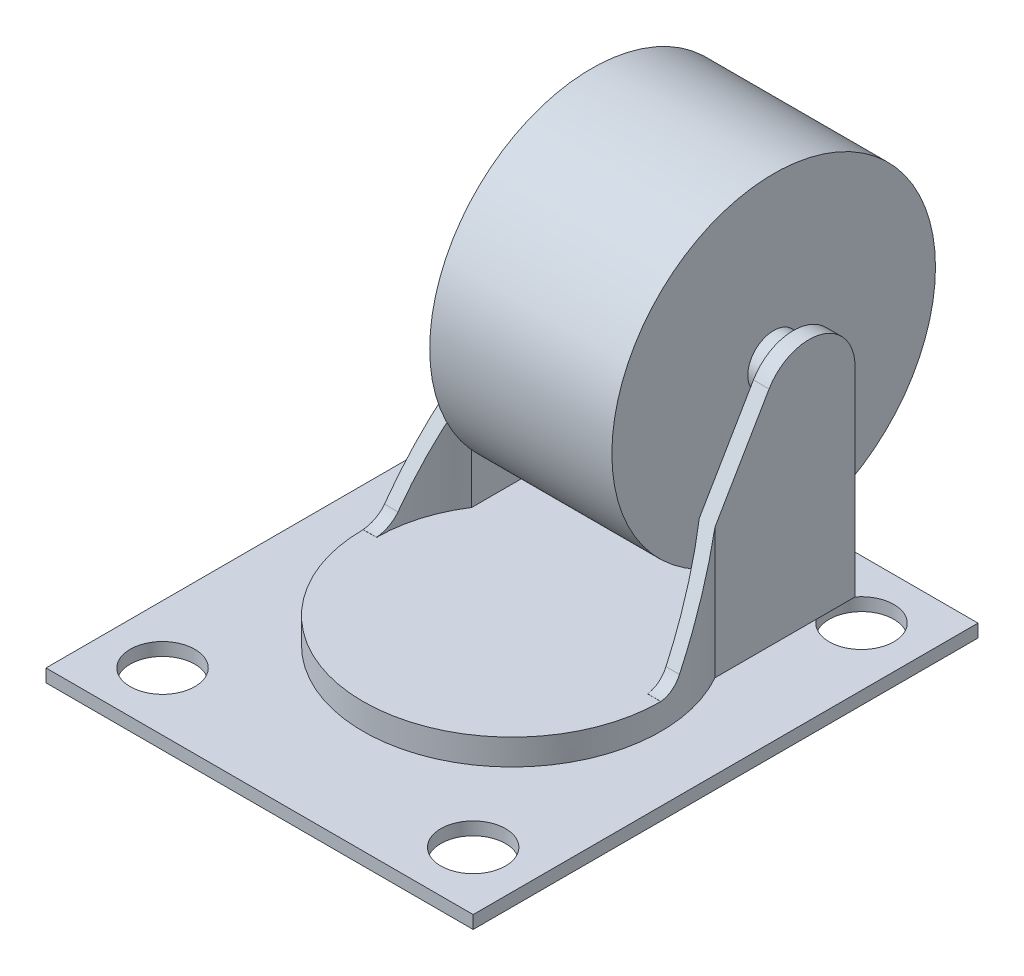
from build123d import *
from build123d.topology import SkipClean

# Parameters (mm, degrees)
SKETCH1_W               = 33
SKETCH1_H               = 39
SKETCH1_R               = 2.5
BOSS_EXTRUDE1_DEPTH     = 1
BOSS_EXTRUDE2_DEPTH     = 2
BOSS_EXTRUDE3_START     = -17
BOSS_EXTRUDE3_DEPTH     = 17
CUT_EXTRUDE1_DEPTH      = 39.503246616
CUT_EXTRUDE1_DEPTH_BACK = 39.503246616


with BuildPart() as part:
    # Sketch1 → Boss-Extrude1 (new body)
    with BuildSketch(Plane(origin=(0, 0, 0), x_dir=(1, 0, 0), z_dir=(0, 1, 0))):
        Rectangle(SKETCH1_W, SKETCH1_H)
        with Locations(Location((12, -15, 0), (0, 0, 270))):
            Circle(SKETCH1_R, mode=Mode.SUBTRACT)
        with Locations(Location((-12, -15, 0), (0, 0, 270))):
            Circle(SKETCH1_R, mode=Mode.SUBTRACT)
        with Locations(Location((-12, 15, 0), (0, 0, 270))):
            Circle(SKETCH1_R, mode=Mode.SUBTRACT)
        with Locations(Location((12, 15, 0), (0, 0, 270))):
            Circle(SKETCH1_R, mode=Mode.SUBTRACT)
    extrude(amount=BOSS_EXTRUDE1_DEPTH)

    # Sketch2 → Boss-Extrude2 (add)
    with BuildSketch(Plane(origin=(0, 1, 0), x_dir=(1, 0, 0), z_dir=(0, 1, 0))):
        with BuildLine():
            Line((10, 5.678908346), (10, 16.5))
            Line((10, 16.5), (-10, 16.5))
            Line((-10, 16.5), (-10, 5.678908346))
            ThreePointArc((-10, 5.678908346), (0, -11.5), (10, 5.678908346))
        make_face()
    extrude(amount=BOSS_EXTRUDE2_DEPTH)

    # Sketch3 → Boss-Extrude3 (add)
    with SkipClean():  # the faces are left unmerged after this step: merging them gives an invalid solid
        with BuildSketch(Plane(origin=(0, 20, 0), x_dir=(1, 0, 0), z_dir=(0, 1, 0)).offset(BOSS_EXTRUDE3_START)):
            with BuildLine():
                Line((-10.466352676, 0), (-11.5, 0))
                ThreePointArc((-11.5, 0), (-11.118677979, 2.936835031), (-10, 5.678908346))
                Line((-10, 5.678908346), (-10, 16.5))
                Line((-10, 16.5), (-8.791731248, 16.5))
                Line((-8.791731248, 16.5), (-8.791731248, 5.678908346))
                ThreePointArc((-8.791731248, 5.678908346), (-10.038971516, 2.960336), (-10.466352676, 0))
            make_face()
            with BuildLine():
                Line((8.791731248, 16.5), (8.791731248, 5.678908346))
                ThreePointArc((8.791731248, 5.678908346), (10.038971516, 2.960336), (10.466352676, 0))
                Line((10.466352676, 0), (11.5, 0))
                ThreePointArc((11.5, 0), (11.118677979, 2.936835031), (10, 5.678908346))
                Line((10, 5.678908346), (10, 16.5))
                Line((10, 16.5), (8.791731248, 16.5))
            make_face()
        extrude(amount=BOSS_EXTRUDE3_DEPTH)

    # Sketch4 → Cut-Extrude1 (cut, two sides: drawn at the far end of the back side and taken through both)
    with SkipClean():  # the faces are left unmerged after this step: merging them gives an invalid solid
        with BuildSketch(Plane(origin=(10, 0, 0), x_dir=(0, 0, -1), z_dir=(1, 0, 0)).offset(-CUT_EXTRUDE1_DEPTH_BACK)):
            with BuildLine():
                Line((-2.613781241, 3), (-0.185143028, 3))
                ThreePointArc((-0.185143028, 3), (0.810549083, 3.265469165), (1.541915642, 3.991402781))
                Line((1.541915642, 3.991402781), (9.859295901, 18.23356349))
                ThreePointArc((9.859295901, 18.23356349), (13.867346815, 19.876273461), (16.5, 16.436490709))
                Line((16.5, 16.436490709), (17.783999393, 20))
                Line((17.783999393, 20), (0.550387099, 24.196515301))
                Line((0.550387099, 24.196515301), (-11.381791723, 8.604740189))
                Line((-11.381791723, 8.604740189), (-2.613781241, 3))
            make_face()
        extrude(amount=CUT_EXTRUDE1_DEPTH + CUT_EXTRUDE1_DEPTH_BACK, mode=Mode.SUBTRACT)

    # Sketch5 → Revolve1 (revolve)
    with SkipClean():  # the faces are left unmerged after this step: merging them gives an invalid solid
        with BuildSketch(Plane(origin=(0, 17, 0), x_dir=(1, 0, 0), z_dir=(0, 1, 0)), mode=Mode.PRIVATE) as revolve1_sk:
            Polygon((7.035069501, 11.179647951), (8.791731248, 11.179647951), (8.791731248, 13.179647951), (0, 13.179647951), (0, 0.679647951), (7.035069501, 0.679647951), align=None)
            Polygon((0, 0.679647951), (0, 13.179647951), (-8.791731248, 13.179647951), (-8.791731248, 11.179647951), (-7.035069501, 11.179647951), (-7.035069501, 0.679647951), align=None)
        revolve(revolve1_sk.sketch.rotate(Axis((8.791731248, 17, -13.179647951), (-1, 0, 0)), 180), axis=Axis((8.791731248, 17, -13.179647951), (-1, 0, 0)))


solid = part.part
